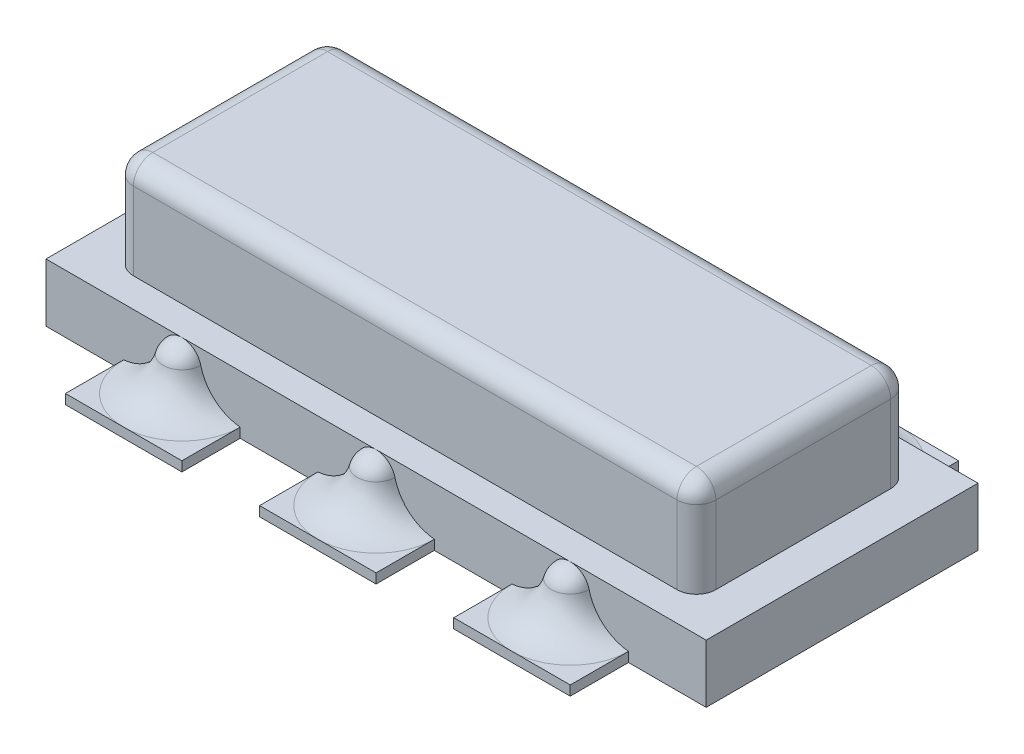
from build123d import *

# Parameters (mm, degrees)
SKETCH1_W            = 3.4
SKETCH1_H            = 1.4
BOSS_EXTRUDE1_DEPTH  = 0.3
SKETCH2_W            = 3
SKETCH2_H            = 1.1
BOSS_EXTRUDE2_DEPTH  = 0.5
FILLET1_R            = 0.1
SKETCH3_W            = 0.6
SKETCH3_H            = 2
BOSS_EXTRUDE3_DEPTH  = 0.05
LPATTERN2_COUNT      = 3
LPATTERN2_PITCH      = 1
LPATTERN2_COUNT_DIR2 = 2
LPATTERN2_PITCH_DIR2 = 1.4


with BuildPart() as part:
    # Sketch1 → Boss-Extrude1 (new body)
    with BuildSketch(Plane(origin=(0, 0, 0), x_dir=(1, 0, 0), z_dir=(0, 1, 0))):
        Rectangle(SKETCH1_W, SKETCH1_H)
    extrude(amount=BOSS_EXTRUDE1_DEPTH)

    # Sketch3 → Boss-Extrude3 (add)
    with BuildSketch(Plane(origin=(0, 0, 0), x_dir=(1, 0, 0), z_dir=(0, 1, 0))):
        Rectangle(SKETCH3_W, SKETCH3_H)
        with Locations((1, 0)):
            Rectangle(SKETCH3_W, SKETCH3_H)
        with Locations((-1, 0)):
            Rectangle(SKETCH3_W, SKETCH3_H)
    extrude(amount=BOSS_EXTRUDE3_DEPTH)

    # Sketch5 → Revolve1 (revolve)
    with BuildSketch(Plane.ZY.offset(-1)):
        with BuildLine():
            Line((0.7, 0.3), (0.7, 0.05))
            Line((0.7, 0.05), (1, 0.05))
            ThreePointArc((1, 0.05), (0.870678479, 0.104483723), (0.797085133, 0.223968247))
            ThreePointArc((0.797085133, 0.223968247), (0.761657016, 0.278729996), (0.7, 0.3))
        make_face()
    revolve1 = revolve(axis=Axis((1, 0.521321821, 0.7), (0, -1, 0)))

    # LPattern2: Revolve1 3 × 2
    with Locations(*[(-i * LPATTERN2_PITCH, 0, -j * LPATTERN2_PITCH_DIR2) for i in range(LPATTERN2_COUNT) for j in range(LPATTERN2_COUNT_DIR2) if (i, j) != (0, 0)]):
        add(revolve1)


with BuildPart() as body_2:
    # Sketch2 → Boss-Extrude2 (new body)
    with BuildSketch(Plane(origin=(0, 0.3, 0), x_dir=(1, 0, 0), z_dir=(0, 1, 0))):
        Rectangle(SKETCH2_W, SKETCH2_H)
    extrude(amount=BOSS_EXTRUDE2_DEPTH)

    # Fillet1
    fillet1_edges = [body_2.edges().sort_by_distance(p)[0] for p in [
        (-1.5, 0.8, 0),
        (0, 0.8, 0.55),
        (1.5, 0.8, 0),
        (0, 0.8, -0.55),
        (1.5, 0.55, 0.55),
        (-1.5, 0.55, 0.55),
        (-1.5, 0.55, -0.55),
        (1.5, 0.55, -0.55),
    ]]
    fillet(fillet1_edges, radius=FILLET1_R)


solid = Compound([part.part, body_2.part])
